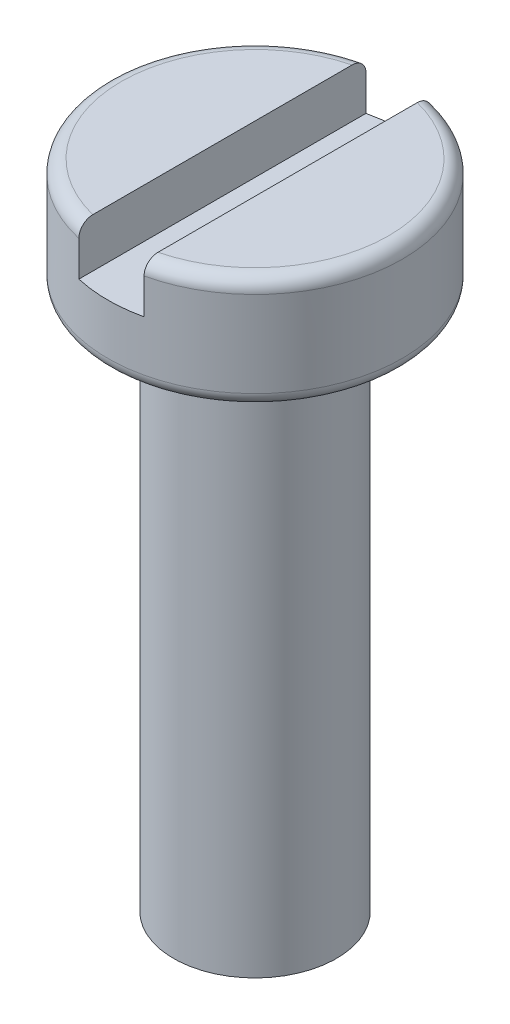
from build123d import *

# Parameters (mm, degrees)
SKETCH1_R             = 2.71
BOSS_EXTRUDE1_DEPTH   = 12
SKETCH2_OUTSIDE_W     = 10.268
SKETCH2_OUTSIDE_H     = 10.268
SKETCH2_OUTSIDE_R     = 1.5
CUT_EXTRUDE1_DEPTH    = 9.92
FILLET1_R             = 0.25
FILLET2_R             = 0.15
SKETCH3_W             = 1.2
SKETCH3_H             = 5.422046684
CUT_EXTRUDE2_DEPTH    = 0.9
BODY_MOVE_COPY1_ANGLE = 180


with BuildPart() as part:
    # Sketch1 → Boss-Extrude1 (new body)
    with BuildSketch(Plane(origin=(0, 0, 0), x_dir=(1, 0, 0), z_dir=(0, 1, 0))):
        with Locations(Location((0, 0, 0), (0, 0, 270))):
            Circle(SKETCH1_R)
    extrude(amount=BOSS_EXTRUDE1_DEPTH)

    # Sketch2 outside → Cut-Extrude1 (cut)
    with BuildSketch(Plane(origin=(0, 12, 0), x_dir=(1, 0, 0), z_dir=(0, 1, 0))):
        Rectangle(SKETCH2_OUTSIDE_W, SKETCH2_OUTSIDE_H)
        with Locations(Location((0, 0, 0), (0, 0, 270))):
            Circle(SKETCH2_OUTSIDE_R, mode=Mode.SUBTRACT)
    extrude(amount=-CUT_EXTRUDE1_DEPTH, mode=Mode.SUBTRACT)

    # Fillet1
    fillet1_edges = [part.edges().sort_by_distance(p)[0] for p in [
        (0, 0, -2.71),
        (0, 2.08, -2.71),
    ]]
    fillet(fillet1_edges, radius=FILLET1_R)

    # Fillet2
    fillet2_edges = [part.edges().sort_by_distance(p)[0] for p in [
        (0, 2.08, -1.5),
    ]]
    fillet(fillet2_edges, radius=FILLET2_R)

    # Sketch3 → Cut-Extrude2 (cut)
    with BuildSketch(Plane.XZ):
        Rectangle(SKETCH3_W, SKETCH3_H)
    extrude(amount=-CUT_EXTRUDE2_DEPTH, mode=Mode.SUBTRACT)


with BuildPart() as part_1:
    # Body-Move/Copy1: moved
    add(part.part.rotate(Axis((0, 10, 0), (1, 0, 0)), BODY_MOVE_COPY1_ANGLE))


solid = part_1.part
